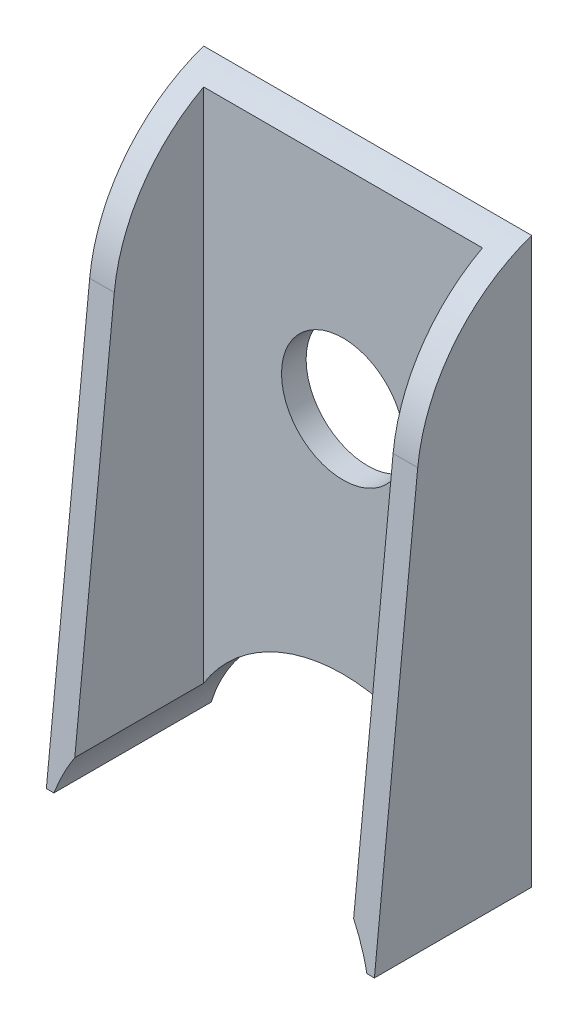
from build123d import *

# Parameters (mm, degrees)
BOSS_EXTRUDE1_DEPTH = 49.53
CUT_EXTRUDE1_DEPTH  = 44.45
SKETCH3_R           = 4.7625
CUT_EXTRUDE2_DEPTH  = 44.45


with BuildPart() as part:
    # Sketch1 → Boss-Extrude1 (new body)
    with BuildSketch(Plane(origin=(0, 0, 0), x_dir=(1, 0, 0), z_dir=(0, 1, 0))):
        Polygon((-12.7, -12.7), (-10.795, -12.7), (-10.795, -1.905), (10.795, -1.905), (10.795, -12.7), (12.7, -12.7), (12.7, 0), (-12.7, 0), align=None)
    extrude(amount=BOSS_EXTRUDE1_DEPTH)

    # Sketch2 → Cut-Extrude1 (cut)
    with BuildSketch(Plane(origin=(12.7, 0, 0), x_dir=(0, 0, -1), z_dir=(1, 0, 0))):
        with BuildLine():
            Line((-12.7, 0), (-8.821918242, 37.623946857))
            ThreePointArc((-8.821918242, 37.623946857), (-4.512325964, 46.11357553), (4.374429599, 49.53))
            Line((4.374429599, 49.53), (-12.7, 49.53))
            Line((-12.7, 49.53), (-12.7, 0))
        make_face()
    extrude(amount=-CUT_EXTRUDE1_DEPTH, mode=Mode.SUBTRACT)

    # Sketch3 → Cut-Extrude2 (cut)
    with BuildSketch(Plane(origin=(0, 0, 0), x_dir=(-1, 0, 0), z_dir=(0, 0, -1))):
        with Locations((0, 31.75)):
            Circle(SKETCH3_R)
        with BuildLine():
            Line((-12.115027858, 5.08), (-12.7, 5.08))
            Line((-12.7, 5.08), (-12.7, 0))
            Line((-12.7, 0), (12.7, 0))
            Line((12.7, 0), (12.7, 5.08))
            Line((12.7, 5.08), (12.115027858, 5.08))
            ThreePointArc((12.115027858, 5.08), (0, 13.97), (-12.115027858, 5.08))
        make_face()
    extrude(amount=-CUT_EXTRUDE2_DEPTH, mode=Mode.SUBTRACT)


solid = part.part
